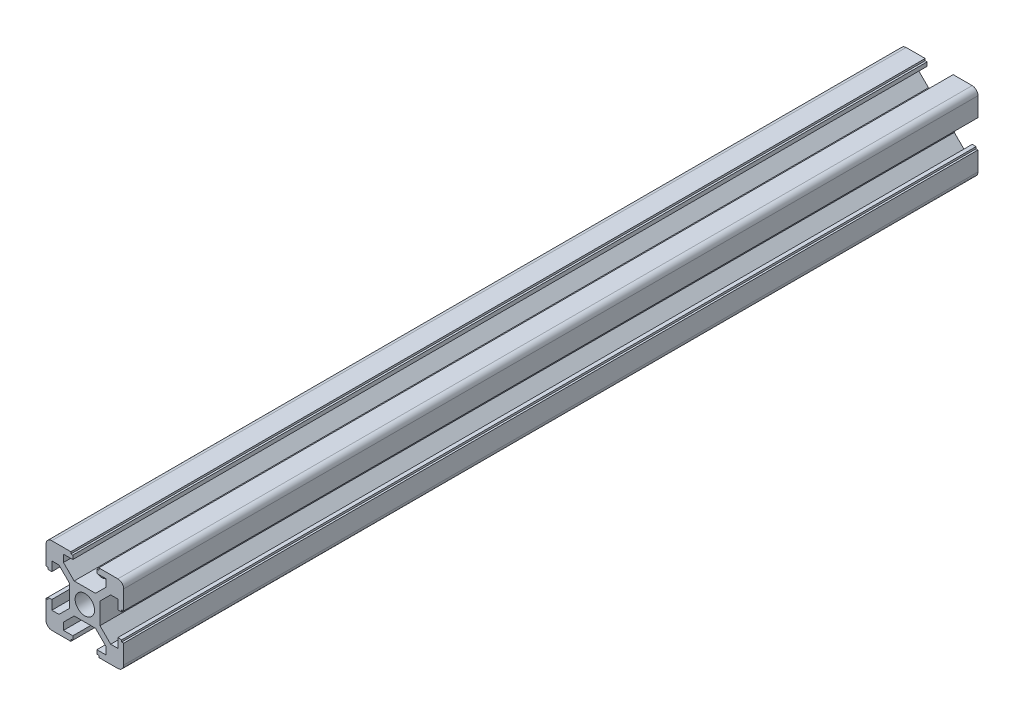
from build123d import *

# Parameters (mm, degrees)
SKETCH1_R           = 2.5
EXTRUDE_1_DEPTH     = 220
SKETCH_1_R          = 1.7
CUT_EXTRUDE_1_DEPTH = 221.665380157


with BuildPart() as part:
    # Sketch1 → 凸台-拉伸1 (new body)
    with BuildSketch(Plane.XY):
        with BuildLine():
            Line((-3.6, 10), (-3.6, 9.5))
            Line((-3.6, 9.5), (-3.1, 9.5))
            Line((-3.1, 9.5), (-3.1, 8.5))
            Line((-3.1, 8.5), (-5.5, 8.5))
            Line((-5.5, 8.5), (-5.5, 6.65))
            Line((-5.5, 6.65), (-2.75, 3.9))
            Line((-2.75, 3.9), (2.75, 3.9))
            Line((2.75, 3.9), (5.5, 6.65))
            Line((5.5, 6.65), (5.5, 8.5))
            Line((5.5, 8.5), (3.1, 8.5))
            Line((3.1, 8.5), (3.1, 9.5))
            Line((3.1, 9.5), (3.6, 9.5))
            Line((3.6, 9.5), (3.6, 10))
            Line((3.6, 10), (8.5, 10))
            ThreePointArc((8.5, 10), (9.560660172, 9.560660172), (10, 8.5))
            Line((10, 8.5), (10, 3.6))
            Line((10, 3.6), (9.5, 3.6))
            Line((9.5, 3.6), (9.5, 3.1))
            Line((9.5, 3.1), (8.5, 3.1))
            Line((8.5, 3.1), (8.5, 5.5))
            Line((8.5, 5.5), (6.65, 5.5))
            Line((6.65, 5.5), (3.9, 2.75))
            Line((3.9, 2.75), (3.9, -2.75))
            Line((3.9, -2.75), (6.65, -5.5))
            Line((6.65, -5.5), (8.5, -5.5))
            Line((8.5, -5.5), (8.5, -3.1))
            Line((8.5, -3.1), (9.5, -3.1))
            Line((9.5, -3.1), (9.5, -3.6))
            Line((9.5, -3.6), (10, -3.6))
            Line((10, -3.6), (10, -8.5))
            ThreePointArc((10, -8.5), (9.560660172, -9.560660172), (8.5, -10))
            Line((8.5, -10), (3.6, -10))
            Line((3.6, -10), (3.6, -9.5))
            Line((3.6, -9.5), (3.1, -9.5))
            Line((3.1, -9.5), (3.1, -8.5))
            Line((3.1, -8.5), (5.5, -8.5))
            Line((5.5, -8.5), (5.5, -6.65))
            Line((5.5, -6.65), (2.75, -3.9))
            Line((2.75, -3.9), (-2.75, -3.9))
            Line((-2.75, -3.9), (-5.5, -6.65))
            Line((-5.5, -6.65), (-5.5, -8.5))
            Line((-5.5, -8.5), (-3.1, -8.5))
            Line((-3.1, -8.5), (-3.1, -9.5))
            Line((-3.1, -9.5), (-3.6, -9.5))
            Line((-3.6, -9.5), (-3.6, -10))
            Line((-3.6, -10), (-8.5, -10))
            ThreePointArc((-8.5, -10), (-9.560660172, -9.560660172), (-10, -8.5))
            Line((-10, -8.5), (-10, -3.6))
            Line((-10, -3.6), (-9.5, -3.6))
            Line((-9.5, -3.6), (-9.5, -3.1))
            Line((-9.5, -3.1), (-8.5, -3.1))
            Line((-8.5, -3.1), (-8.5, -5.5))
            Line((-8.5, -5.5), (-6.65, -5.5))
            Line((-6.65, -5.5), (-3.9, -2.75))
            Line((-3.9, -2.75), (-3.9, 2.75))
            Line((-3.9, 2.75), (-6.65, 5.5))
            Line((-6.65, 5.5), (-8.5, 5.5))
            Line((-8.5, 5.5), (-8.5, 3.1))
            Line((-8.5, 3.1), (-9.5, 3.1))
            Line((-9.5, 3.1), (-9.5, 3.6))
            Line((-9.5, 3.6), (-10, 3.6))
            Line((-10, 3.6), (-10, 8.5))
            ThreePointArc((-10, 8.5), (-9.560660172, 9.560660172), (-8.5, 10))
            Line((-8.5, 10), (-3.6, 10))
        make_face()
        Circle(SKETCH1_R, mode=Mode.SUBTRACT)
    extrude(amount=EXTRUDE_1_DEPTH)

    # 草图1 → 切除-拉伸1 (cut, through all)
    with BuildSketch(Plane(origin=(0, 3.9, 0), x_dir=(1, 0, 0), z_dir=(0, 1, 0))):
        with Locations(Location((0, -214, 0), (0, 0, 180))):
            Circle(SKETCH_1_R)
        with Locations(Location((0, -6, 0), (0, 0, 180))):
            Circle(SKETCH_1_R)
    extrude(amount=-CUT_EXTRUDE_1_DEPTH, mode=Mode.SUBTRACT)


solid = part.part
